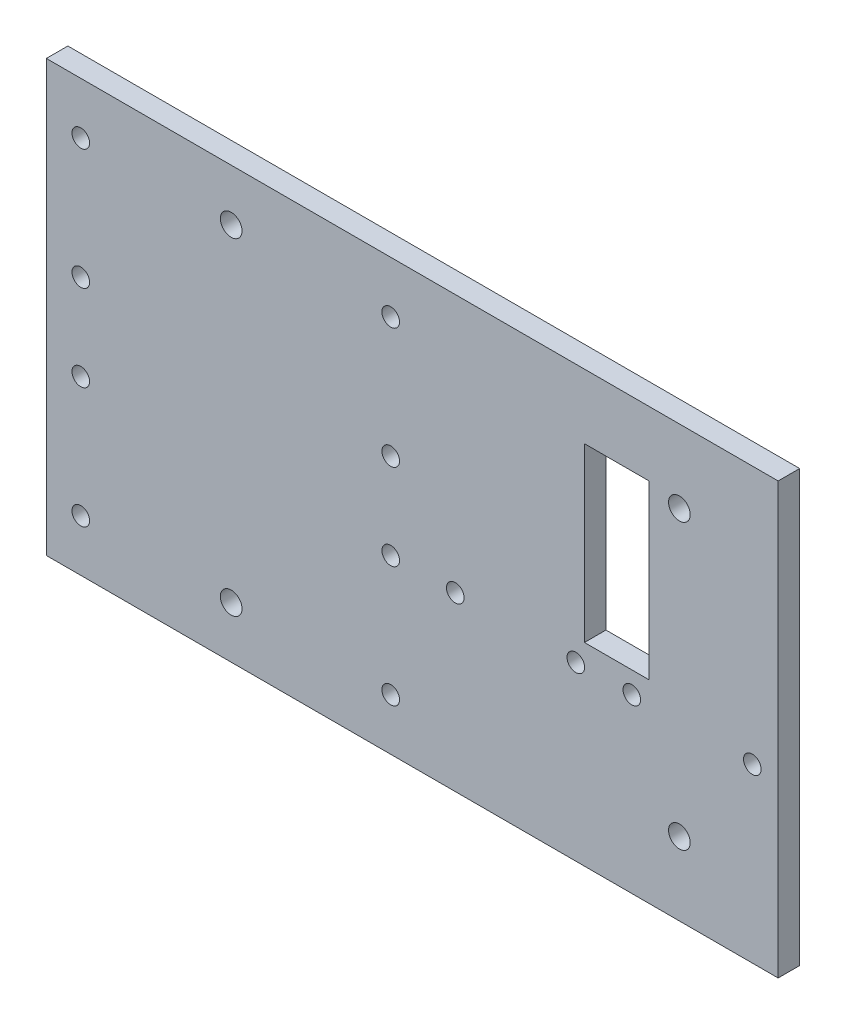
from build123d import *

# Parameters (mm, degrees)
SKETCH1_W               = 95.25
SKETCH1_H               = 63.5
BOSS_EXTRUDE1_DEPTH     = 3.175
SKETCH2_R               = 1.6
CUT_EXTRUDE1_DEPTH      = 58.326117521
CUT_EXTRUDE2_DEPTH      = 58.326117521
CUT_EXTRUDE2_DEPTH_BACK = 58.326117521
SKETCH3_W               = 9.525
SKETCH3_H               = 25.4
SKETCH5_W               = 12.7
SKETCH5_H               = 63.5
BOSS_EXTRUDE2_DEPTH     = 3.175
SKETCH7_R               = 1.3
CUT_EXTRUDE3_DEPTH      = 69.244038201
SKETCH8_R               = 1.29999994
CUT_EXTRUDE4_DEPTH      = 3.175


with BuildPart() as part:
    # Sketch1 → Boss-Extrude1 (new body)
    with BuildSketch(Plane.XY):
        Rectangle(SKETCH1_W, SKETCH1_H)
    extrude(amount=BOSS_EXTRUDE1_DEPTH)

    # Sketch2 → Cut-Extrude1 (cut, through all)
    with BuildSketch(Plane.XY.offset(3.175)):
        with Locations((33.0581, 20.955)):
            Circle(SKETCH2_R)
        with Locations((33.0581, -20.955)):
            Circle(SKETCH2_R)
        with Locations((-33.0581, 24.13)):
            Circle(SKETCH2_R)
        with Locations((-33.0581, -24.13)):
            Circle(SKETCH2_R)
    extrude(amount=-CUT_EXTRUDE1_DEPTH, mode=Mode.SUBTRACT)

    # Sketch3 → Cut-Extrude2 (cut, two sides: drawn at the far end of the back side and taken through both)
    with BuildSketch(Plane.XY.offset(3.175).offset(-CUT_EXTRUDE2_DEPTH_BACK)):
        with Locations((23.8125, 9.525)):
            Rectangle(SKETCH3_W, SKETCH3_H)
    extrude(amount=CUT_EXTRUDE2_DEPTH + CUT_EXTRUDE2_DEPTH_BACK, mode=Mode.SUBTRACT)

    # Sketch5 → Boss-Extrude2 (add)
    with BuildSketch(Plane.XY.offset(3.175)):
        with Locations((-53.975, 0)):
            Rectangle(SKETCH5_W, SKETCH5_H)
    extrude(amount=-BOSS_EXTRUDE2_DEPTH)

    # Sketch7 → Cut-Extrude3 (cut, through all)
    with BuildSketch(Plane.XY.offset(3.175)):
        with Locations((-55.245, 24.13)):
            Circle(SKETCH7_R)
        with Locations((-9.525, 24.13)):
            Circle(SKETCH7_R)
        with Locations((-9.525, 6.35)):
            Circle(SKETCH7_R)
        with Locations((-55.245, 6.35)):
            Circle(SKETCH7_R)
        with Locations((-55.245, -6.35)):
            Circle(SKETCH7_R)
        with Locations((-9.525, -6.35)):
            Circle(SKETCH7_R)
        with Locations((-9.525, -24.13)):
            Circle(SKETCH7_R)
        with Locations((-55.245, -24.13)):
            Circle(SKETCH7_R)
    extrude(amount=-CUT_EXTRUDE3_DEPTH, mode=Mode.SUBTRACT)

    # Sketch8 → Cut-Extrude4 (cut)
    with BuildSketch(Plane.XY.offset(3.175)):
        with Locations((0, -6.35)):
            Circle(SKETCH8_R)
        with Locations((43.815, -6.35)):
            Circle(SKETCH8_R)
        with Locations((17.78, -6.35)):
            Circle(SKETCH8_R)
        with Locations((26.035, -6.35)):
            Circle(SKETCH8_R)
    extrude(amount=-CUT_EXTRUDE4_DEPTH, mode=Mode.SUBTRACT)


solid = part.part
